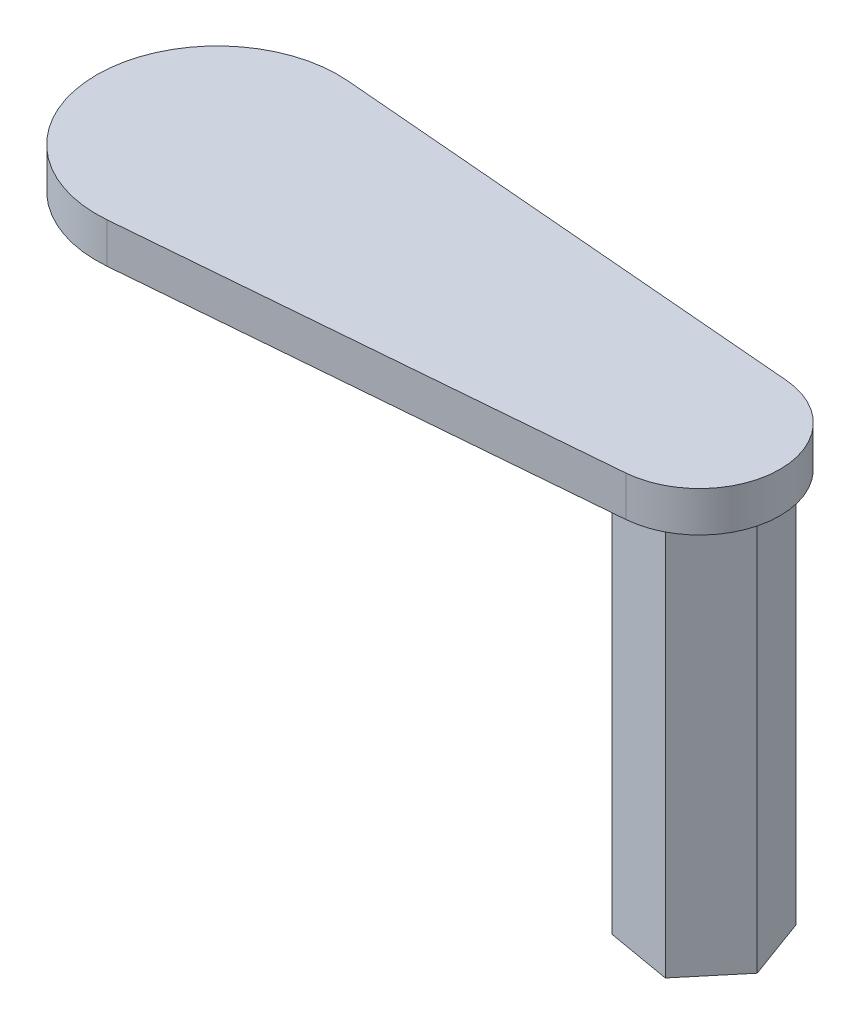
from build123d import *

# Parameters (mm, degrees)
SKETCH_1_R      = 15
SKETCH_1_R_2    = 8.5
SKETCH_1_R_3    = 10
EXTRUDE_5_DEPTH = 5
EXTRUDE_START   = -3
SKETCH_3_R      = 8.5
EXTRUDE_6_DEPTH = 3
EXTRUDE_8_DEPTH = 50


with BuildPart() as part:
    # 草图1 → 凸台-拉伸5 (new body)
    # profile 1 of 3: a face of its own
    with BuildSketch(Plane(origin=(0, 0, 0), x_dir=(1, 0, 0), z_dir=(0, 1, 0))):
        Circle(SKETCH_1_R)
        with Locations(Location((0, 0, 0), (0, 0, 270))):
            Circle(SKETCH_1_R_2, mode=Mode.SUBTRACT)
    # profile 2 of 3: a face of its own
    with BuildSketch(Plane(origin=(0, 0, 0), x_dir=(1, 0, 0), z_dir=(0, 1, 0))):
        with BuildLine():
            Line((60.699439854, 9.965059042), (1.252835242, 14.947588563))
            ThreePointArc((1.252835242, 14.947588563), (11.040664125, 10.154000969), (15, 0))
            ThreePointArc((15, 0), (11.040664125, -10.154000969), (1.252835242, -14.947588563))
            Line((1.252835242, -14.947588563), (60.699439854, -9.965059042))
            ThreePointArc((60.699439854, -9.965059042), (49.864216359, 0), (60.699439854, 9.965059042))
        make_face()
    # profile 3 of 3: a face of its own
    with BuildSketch(Plane(origin=(0, 0, 0), x_dir=(1, 0, 0), z_dir=(0, 1, 0))):
        with Locations((59.864216359, 0)):
            Circle(SKETCH_1_R_3)
    extrude(amount=EXTRUDE_5_DEPTH)

    # 草图3 → 凸台-拉伸6 (add)
    with BuildSketch(Plane(origin=(0, 5, 0), x_dir=(1, 0, 0), z_dir=(0, 1, 0)).offset(EXTRUDE_START)):
        with Locations(Location((0, 0, 0), (0, 0, 270))):
            Circle(SKETCH_3_R)
    extrude(amount=EXTRUDE_6_DEPTH)

    # 草图4 → 凸台-拉伸8 (add)
    with BuildSketch(Plane(origin=(0, 0, 0), x_dir=(-1, 0, 0), z_dir=(0, -1, 0))):
        Polygon((-64.16134725, -4.724526638), (-64.16134725, 5.275473362), (-54.280111118, 5.275473362), (-56.872098045, 8.381028801), (-64.852894721, 6.995424542), (-67.643324571, -0.608950251), (-62.452957745, -6.827720786), (-54.472161069, -5.442116527), (-54.208841033, -4.724526638), align=None)
        Polygon((-51.681731219, 2.162258266), (-54.16134725, 5.133177977), (-54.16134725, -4.595098362), align=None)
        Polygon((-54.280111118, 5.275473362), (-64.16134725, 5.275473362), (-64.16134725, -4.724526638), (-54.208841033, -4.724526638), (-54.16134725, -4.595098362), (-54.16134725, 5.133177977), align=None)
    extrude(amount=EXTRUDE_8_DEPTH)


solid = part.part
